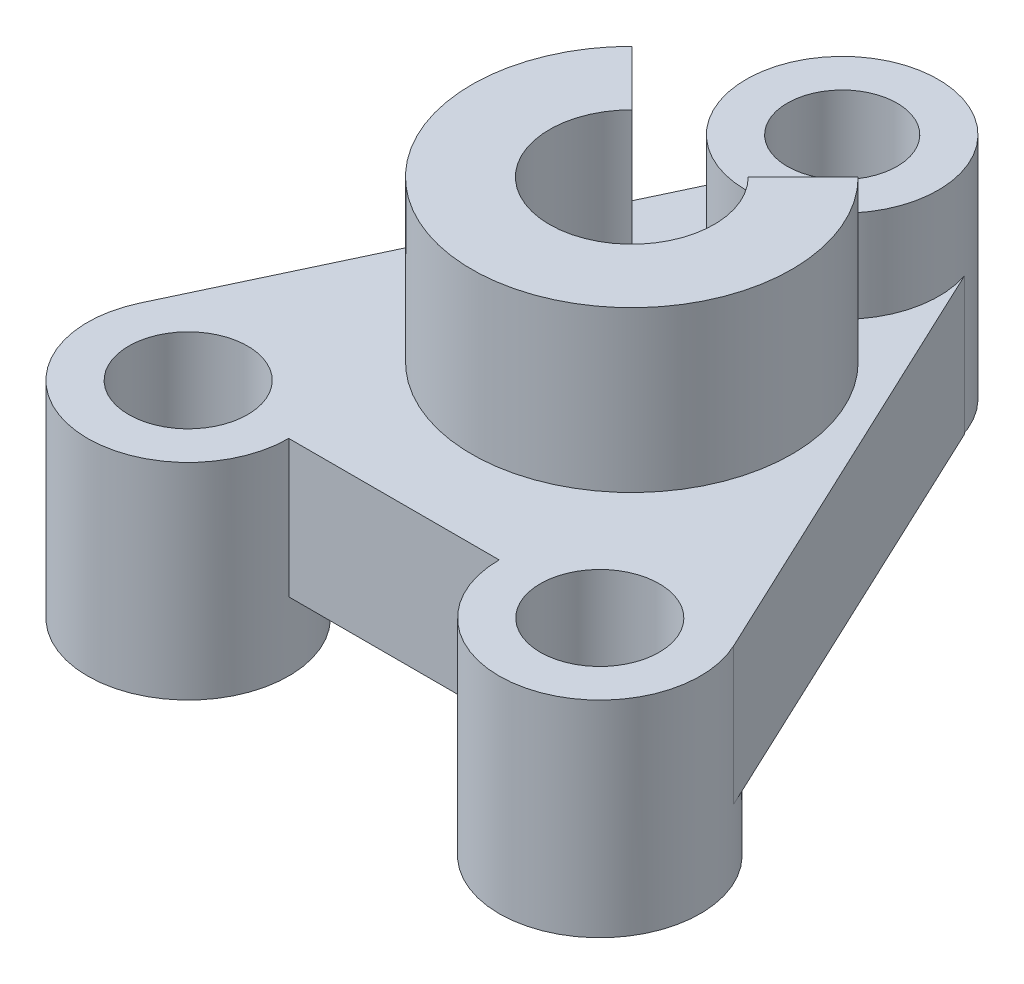
from build123d import *

# Parameters (mm, degrees)
SKETCH1_R             = 21
SKETCH1_R_2           = 12
BOSS_EXTRUDE1_DEPTH   = 50
SKETCH2_R             = 13
BOSS_EXTRUDE2_DEPTH   = 45
BOSS_EXTRUDE2_2_DEPTH = 45
BOSS_EXTRUDE3_DEPTH   = 30
BOSS_EXTRUDE4_DEPTH   = 35


with BuildPart() as part:
    # Sketch1 → Boss-Extrude1 (new body)
    with BuildSketch(Plane(origin=(0, 0, 0), x_dir=(1, 0, 0), z_dir=(0, 1, 0))):
        with Locations(Location((0, 78.9710862, 0), (0, 0, 270))):
            Circle(SKETCH1_R)
        with Locations(Location((0, 78.9710862, 0), (0, 0, 270))):
            Circle(SKETCH1_R_2, mode=Mode.SUBTRACT)
    extrude(amount=BOSS_EXTRUDE1_DEPTH)


with BuildPart() as body_2:
    # Sketch2 → Boss-Extrude2 (new body)
    with BuildSketch(Plane(origin=(0, 30, 0), x_dir=(1, 0, 0), z_dir=(0, 1, 0))):
        with BuildLine():
            ThreePointArc((-23, -19.0289138), (-40.201759921, 2.441458626), (-64.906990195, -9.663459119))
            ThreePointArc((-64.906990195, -9.663459119), (-66.470372427, -14.230673721), (-67, -19.0289138))
            ThreePointArc((-67, -19.0289138), (-45, -41.0289138), (-23, -19.0289138))
        make_face()
        with Locations(Location((-45, -19.0289138, 0), (0, 0, 270))):
            Circle(SKETCH2_R, mode=Mode.SUBTRACT)
    extrude(amount=-BOSS_EXTRUDE2_DEPTH)



with BuildPart() as body_3:
    # Sketch2 → Boss-Extrude2 2 (new body)
    with BuildSketch(Plane(origin=(0, 30, 0), x_dir=(1, 0, 0), z_dir=(0, 1, 0))):
        with BuildLine():
            ThreePointArc((64.906990195, -9.663459119), (40.201759921, 2.441458626), (23, -19.0289138))
            ThreePointArc((23, -19.0289138), (45, -41.0289138), (67, -19.0289138))
            ThreePointArc((67, -19.0289138), (66.470372427, -14.230673721), (64.906990195, -9.663459119))
        make_face()
        with Locations(Location((45, -19.0289138, 0), (0, 0, 270))):
            Circle(SKETCH2_R, mode=Mode.SUBTRACT)
    extrude(amount=-BOSS_EXTRUDE2_2_DEPTH)


with BuildPart() as body_2_1:
    add(body_2.part)

    add(body_3.part)  # Boss-Extrude3 merges body 3
    # Sketch3 → Boss-Extrude3 (add)
    with BuildSketch(Plane(origin=(0, 30, 0), x_dir=(1, 0, 0), z_dir=(0, 1, 0))):
        with BuildLine():
            Line((-64.906990195, -9.663459119), (-20.089465247, 85.5996178))
            ThreePointArc((-20.089465247, 85.5996178), (0, 57.816322077), (20.089465247, 85.5996178))
            Line((20.089465247, 85.5996178), (64.906990195, -9.663459119))
            ThreePointArc((64.906990195, -9.663459119), (40.201759921, 2.441458626), (23, -19.0289138))
            Line((23, -19.0289138), (-23, -19.0289138))
            ThreePointArc((-23, -19.0289138), (-40.201759921, 2.441458626), (-64.906990195, -9.663459119))
        make_face()
    extrude(amount=-BOSS_EXTRUDE3_DEPTH)

    # Sketch5 → Boss-Extrude4 (add)
    with BuildSketch(Plane(origin=(0, 65, 0), x_dir=(1, 0, 0), z_dir=(0, 1, 0))):
        with BuildLine():
            Line((-12.727922061, 45.699008261), (-24.748737342, 57.719823541))
            ThreePointArc((-24.748737342, 57.719823541), (0, -2.0289138), (24.748737342, 57.719823541))
            Line((24.748737342, 57.719823541), (12.727922061, 45.699008261))
            ThreePointArc((12.727922061, 45.699008261), (0, 14.9710862), (-12.727922061, 45.699008261))
        make_face()
    extrude(amount=-BOSS_EXTRUDE4_DEPTH)


solid = Compound([part.part, body_2_1.part])
